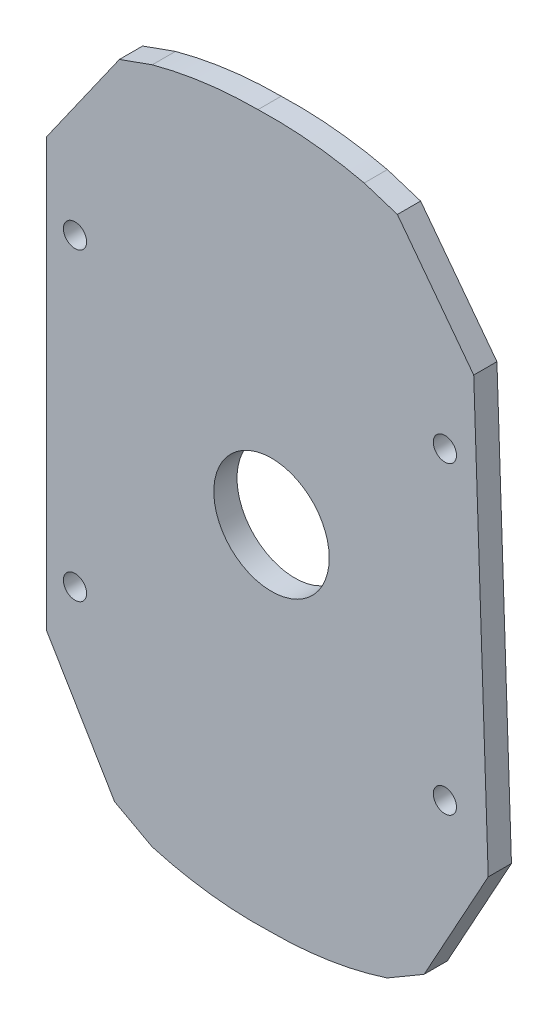
from build123d import *

# Parameters (mm, degrees)
BOSS_EXTRUDE2_DEPTH = 3
SKETCH3_R           = 1.5
SKETCH3_R_2         = 7.46
CUT_EXTRUDE1_DEPTH  = 3


with BuildPart() as part:
    # Sketch2 → Boss-Extrude2 (new body)
    with BuildSketch(Plane.XY):
        with BuildLine():
            Line((116.251704746, 156.353577499), (112.006054704, 154.834164358))
            Line((112.006054704, 154.834164358), (102.590821765, 141.464685362))
            Line((102.590821765, 141.464685362), (102.590821765, 86.213632981))
            Line((102.590821765, 86.213632981), (111.385068158, 71.453251655))
            Line((111.385068158, 71.453251655), (116.251704746, 68.818910417))
            ThreePointArc((116.251704746, 68.818910417), (123.784731531, 67.289899242), (131.464672299, 66.969153974))
            ThreePointArc((131.464672299, 66.969153974), (139.129294477, 67.550475385), (146.606062492, 69.334377784))
            Line((146.606062492, 69.334377784), (151.380447861, 72.132439574))
            Line((151.380447861, 72.132439574), (159.66845659, 87.18290594))
            Line((159.66845659, 87.18290594), (157.79248846, 142.402101269))
            Line((157.79248846, 142.402101269), (147.928743251, 155.444191223))
            Line((147.928743251, 155.444191223), (143.63395176, 156.818573493))
            ThreePointArc((143.63395176, 156.818573493), (136.819761385, 157.949780649), (129.915894372, 158.172132571))
            ThreePointArc((129.915894372, 158.172132571), (123.023557673, 157.715498216), (116.251704746, 156.353577499))
        make_face()
    extrude(amount=BOSS_EXTRUDE2_DEPTH)

    # Sketch3 → Cut-Extrude1 (cut)
    with BuildSketch(Plane.XY.offset(3)):
        with Locations((106.270821765, 132.294685362)):
            Circle(SKETCH3_R)
        with Locations((106.270821765, 92.943632981)):
            Circle(SKETCH3_R)
        with Locations((154.065868873, 132.294685362)):
            Circle(SKETCH3_R)
        with Locations((154.065868873, 92.943632981)):
            Circle(SKETCH3_R)
        with Locations((131.66355574, 112.585551326)):
            Circle(SKETCH3_R_2)
    extrude(amount=-CUT_EXTRUDE1_DEPTH, mode=Mode.SUBTRACT)


solid = part.part
